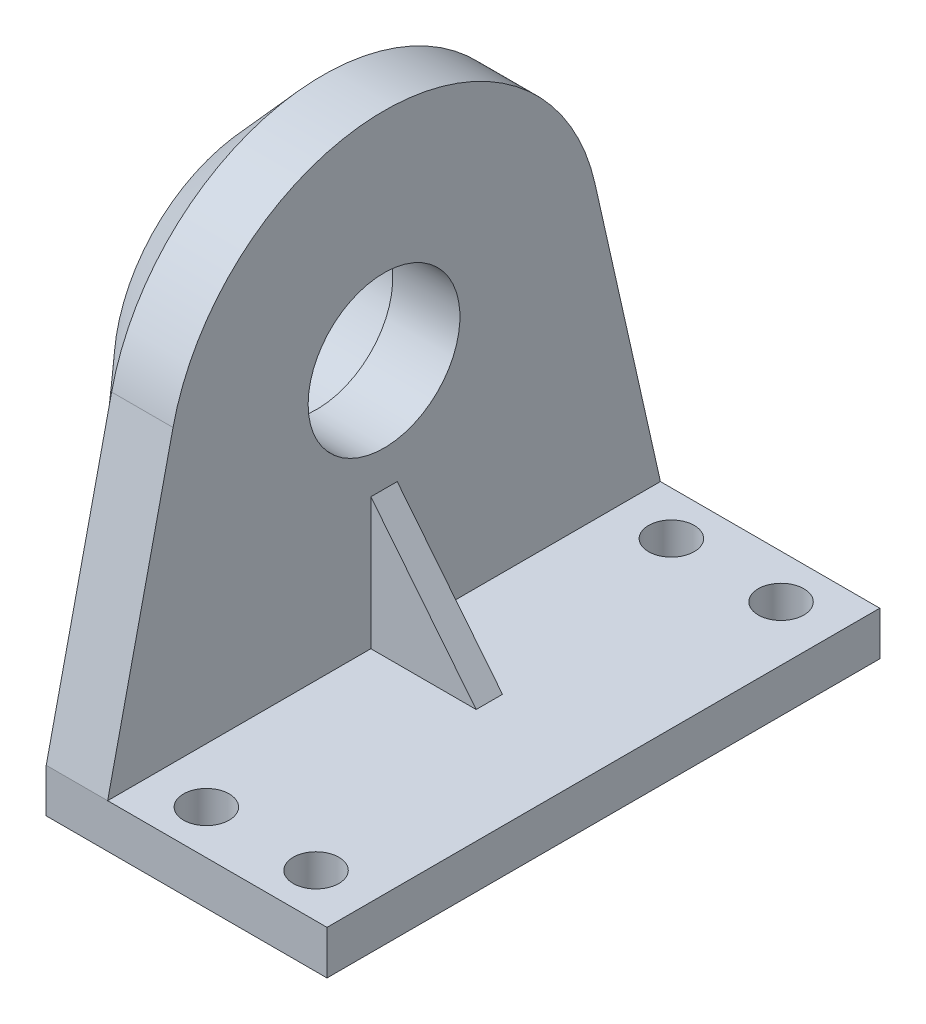
from build123d import *

# Parameters (mm, degrees)
BOSS_EXTRUDE1_START = -7
BOSS_EXTRUDE1_DEPTH = 7
SKETCH6_W           = 63
SKETCH6_H           = 5
BOSS_EXTRUDE2_DEPTH = 25
SKETCH7_R           = 2.6
CUT_EXTRUDE1_DEPTH  = 73.836579806
BOSS_EXTRUDE3_DEPTH = 1.5


with BuildPart() as part:
    # Sketch4 → Revolve1 (revolve)
    with BuildSketch(Plane.XY, mode=Mode.PRIVATE) as revolve1_sk:
        Polygon((0, 11.15), (7, 11.15), (7, 8.65), (14.653434377, 8.65), (14.653434377, 24.65), (7.653434377, 24.65), (0, 16.15), align=None)
    revolve(revolve1_sk.sketch.rotate(Axis((0, 0, 0), (1, 0, 0)), 90), axis=Axis((0, 0, 0), (1, 0, 0)))

    # Sketch5 → Boss-Extrude1 (add)
    with BuildSketch(Plane(origin=(14.653434377, 0, 0), x_dir=(0, 0, -1), z_dir=(1, 0, 0)).offset(BOSS_EXTRUDE1_START)):
        with BuildLine():
            Line((-31.5, -32.7), (31.5, -32.7))
            Line((31.5, -32.7), (31.5, -27.7))
            Line((31.5, -27.7), (24.048586045, 5.411839727))
            ThreePointArc((24.048586045, 5.411839727), (0, -24.65), (-24.048586045, 5.411839727))
            Line((-24.048586045, 5.411839727), (-31.5, -27.7))
            Line((-31.5, -27.7), (-31.5, -32.7))
        make_face()
    extrude(amount=BOSS_EXTRUDE1_DEPTH)

    # Sketch6 → Boss-Extrude2 (add)
    with BuildSketch(Plane(origin=(14.653434377, 0, 0), x_dir=(0, 0, -1), z_dir=(1, 0, 0))):
        with Locations((0, -30.2)):
            Rectangle(SKETCH6_W, SKETCH6_H)
    extrude(amount=BOSS_EXTRUDE2_DEPTH)

    # Sketch7 → Cut-Extrude1 (cut, through all)
    with BuildSketch(Plane(origin=(0, -27.7, 0), x_dir=(1, 0, 0), z_dir=(0, 1, 0))):
        with Locations(Location((20.903434377, 26.5, 0), (0, 0, 270))):
            Circle(SKETCH7_R)
        with Locations(Location((33.403434377, 26.5, 0), (0, 0, 270))):
            Circle(SKETCH7_R)
        with Locations(Location((33.403434377, -26.5, 0), (0, 0, 270))):
            Circle(SKETCH7_R)
        with Locations(Location((20.903434377, -26.5, 0), (0, 0, 270))):
            Circle(SKETCH7_R)
    extrude(amount=-CUT_EXTRUDE1_DEPTH, mode=Mode.SUBTRACT)

    # Sketch8 → Boss-Extrude3 (add, symmetric)
    with BuildSketch(Plane.XY):
        Polygon((26.653434377, -27.7), (14.653434377, -12.7), (14.653434377, -27.7), align=None)
    extrude(amount=BOSS_EXTRUDE3_DEPTH, both=True)


solid = part.part
